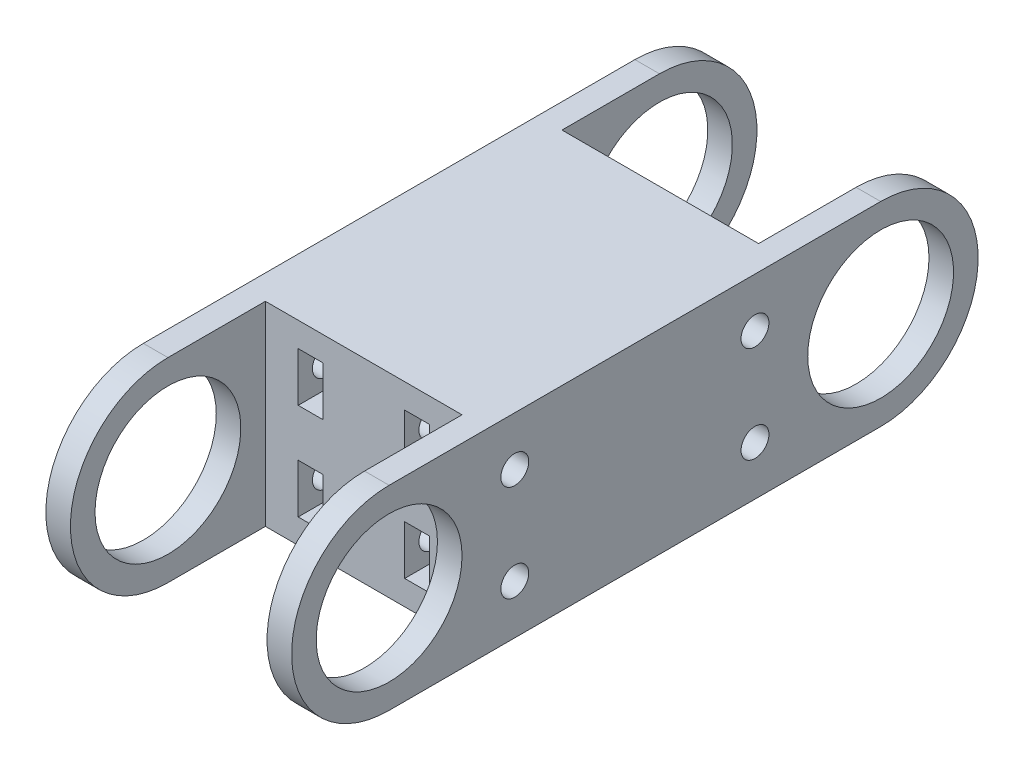
from build123d import *

# Parameters (mm, degrees)
SKETCH1_R            = 8.9
BOSS_EXTRUDE1_DEPTH  = 30
SKETCH2_W            = 24
SKETCH2_H            = 23.8
CUT_EXTRUDE1_DEPTH   = 82.46195431
M3_CLEARANCE_HOLE1_D = 3.4
SKETCH4_W            = 3
SKETCH4_H            = 6
CUT_EXTRUDE2_DEPTH   = 6.19


with BuildPart() as part:
    # Sketch1 → Boss-Extrude1 (new body)
    with BuildSketch(Plane(origin=(0, 0, 0), x_dir=(0, 0, -1), z_dir=(1, 0, 0))):
        with BuildLine():
            Line((0, 11.9), (60, 11.9))
            ThreePointArc((60, 11.9), (71.9, 0), (60, -11.9))
            Line((60, -11.9), (0, -11.9))
            ThreePointArc((0, -11.9), (-11.9, 0), (0, 11.9))
        make_face()
        Circle(SKETCH1_R, mode=Mode.SUBTRACT)
        with Locations(Location((60, 0, 0), (0, 0, 180))):
            Circle(SKETCH1_R, mode=Mode.SUBTRACT)
    extrude(amount=BOSS_EXTRUDE1_DEPTH)

    # Sketch2 → Cut-Extrude1 (cut, through all)
    with BuildSketch(Plane(origin=(0, 11.9, 0), x_dir=(1, 0, 0), z_dir=(0, 1, 0))):
        with Locations((15, 0)):
            Rectangle(SKETCH2_W, SKETCH2_H)
        with Locations((15, 60)):
            Rectangle(SKETCH2_W, SKETCH2_H)
    extrude(amount=-CUT_EXTRUDE1_DEPTH, mode=Mode.SUBTRACT)

    # M3 Clearance Hole1 (through all)
    with Locations(Plane(origin=(30, -5.9, -15.34), x_dir=(0, 0, 1), z_dir=(1, 0, 0))):
        with Locations((0, 0), (0, -11.8), (-29.32, -11.8), (-29.32, 0)):
            Hole(M3_CLEARANCE_HOLE1_D / 2)

    # Sketch4 → Cut-Extrude2 (cut)
    with BuildSketch(Plane(origin=(0, 0, -48.1), x_dir=(-1, 0, 0), z_dir=(0, 0, -1))):
        with Locations((-21.5, -5.9)):
            Rectangle(SKETCH4_W, SKETCH4_H)
        with Locations((-21.5, 5.9)):
            Rectangle(SKETCH4_W, SKETCH4_H)
        with Locations((-8.5, -5.9)):
            Rectangle(SKETCH4_W, SKETCH4_H)
        with Locations((-8.5, 5.9)):
            Rectangle(SKETCH4_W, SKETCH4_H)
    cut_extrude2 = extrude(amount=-CUT_EXTRUDE2_DEPTH, mode=Mode.SUBTRACT)

    # Mirror1: Cut-Extrude2 across plane
    add(cut_extrude2.mirror(Plane.XY.offset(-30)), mode=Mode.SUBTRACT)


solid = part.part
